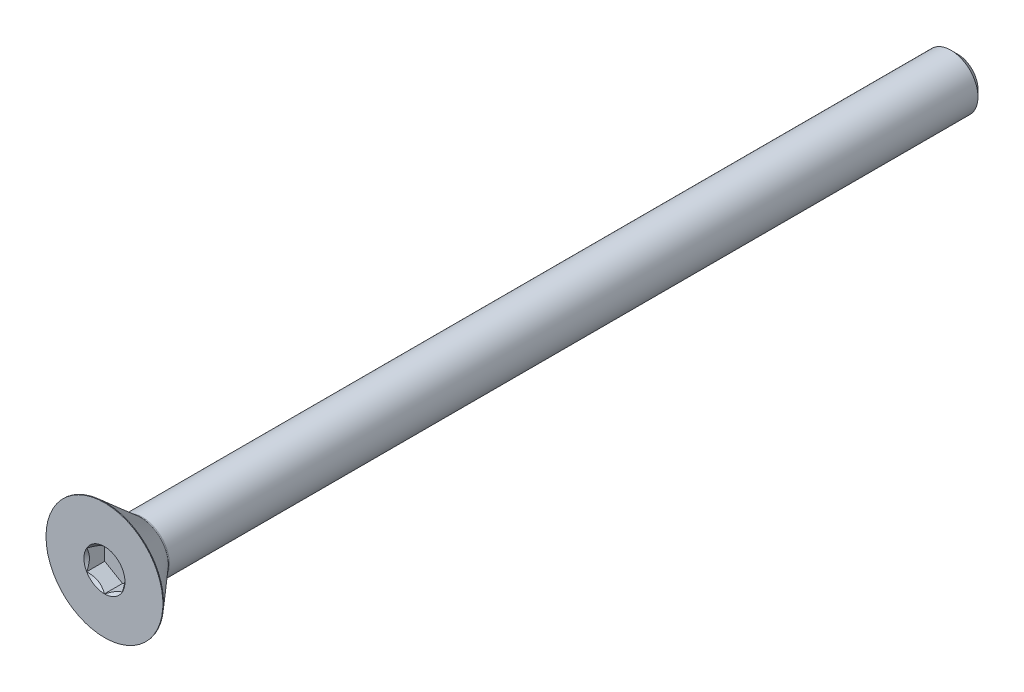
from build123d import *

# Parameters (mm, degrees)
SKETCH10_R         = 1.833087105
CUT_EXTRUDE2_DEPTH = 1.6129
CUT_EXTRUDE2_DRAFT = -45
CUT_EXTRUDE1_DEPTH = 1.6129


with BuildPart() as part:
    # Sketch2 → Revolve1 (revolve)
    with BuildSketch(Plane(origin=(0, 0, 0), x_dir=(0, 0, -1), z_dir=(1, 0, 0)), mode=Mode.PRIVATE) as revolve1_sk:
        with BuildLine():
            Line((-38.035484, 5.2197), (-34.8742, 2.471637744))
            ThreePointArc((-34.8742, 2.471637744), (-34.80108483, 2.428138789), (-34.717366229, 2.413))
            Line((-34.717366229, 2.413), (37.5046875, 2.413))
            Line((37.5046875, 2.413), (38.1, 1.8176875))
            Line((38.1, 1.8176875), (38.1, 0))
            Line((38.1, 0), (-38.1, 0))
            Line((-38.1, 0), (-38.1, 5.2197))
            Line((-38.1, 5.2197), (-38.035484, 5.2197))
        make_face()
    revolve(revolve1_sk.sketch.rotate(Axis((0, 0, -38.1), (0, 0, 1)), 90), axis=Axis((0, 0, -38.1), (0, 0, 1)))


with BuildPart() as cut_extrude2_tool:
    # Sketch10 → Cut-Extrude2 (with draft: the straight prism first)
    with BuildSketch(Plane.XY.offset(38.1)):
        Circle(SKETCH10_R)
    extrude(amount=-CUT_EXTRUDE2_DEPTH)
    # Cut-Extrude2: the draft: its side faces are tilted about the plane it starts from
    cut_extrude2_sides = [cut_extrude2_tool.faces().sort_by_distance(p)[0] for p in [
        (-1.833087105, 0, 37.29355),
    ]]
    draft(cut_extrude2_sides, Plane.XY.offset(38.1), CUT_EXTRUDE2_DRAFT)


with BuildPart() as part_1:
    add(part.part)

    # Cut-Extrude2: cut by cut_extrude2_tool
    add(cut_extrude2_tool.part, mode=Mode.SUBTRACT)

    # Sketch9 → Cut-Extrude1 (cut)
    with BuildSketch(Plane.XY.offset(38.1)):
        Polygon((1.5875, -0.916543552), (1.5875, 0.916543552), (0, 1.833087105), (-1.5875, 0.916543552), (-1.5875, -0.916543552), (0, -1.833087105), align=None)
    extrude(amount=-CUT_EXTRUDE1_DEPTH, mode=Mode.SUBTRACT)


solid = part_1.part
